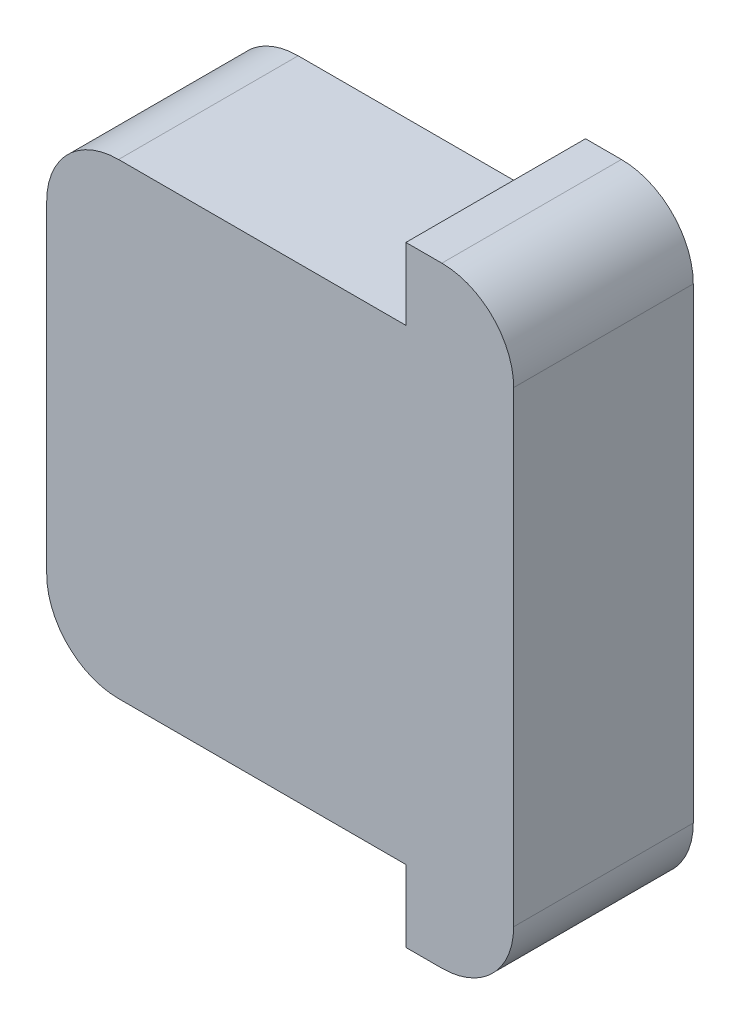
from build123d import *

# Parameters (mm, degrees)
BOSS_EXTRU_1_DEPTH = 5
CONG_1_R           = 2


with BuildPart() as part:
    # Esquisse1 → Boss.-Extru.1 (new body)
    with BuildSketch(Plane.XY):
        Polygon((0, 6.5), (0, 8.5), (3, 8.5), (3, -8.5), (0, -8.5), (0, -6.5), (-10, -6.5), (-10, 6.5), align=None)
    extrude(amount=BOSS_EXTRU_1_DEPTH)

    # Congé1
    cong_1_edges = [part.edges().sort_by_distance(p)[0] for p in [
        (-10, 6.5, 2.5),
        (3, 8.5, 2.5),
        (3, -8.5, 2.5),
        (-10, -6.5, 2.5),
    ]]
    fillet(cong_1_edges, radius=CONG_1_R)


solid = part.part
